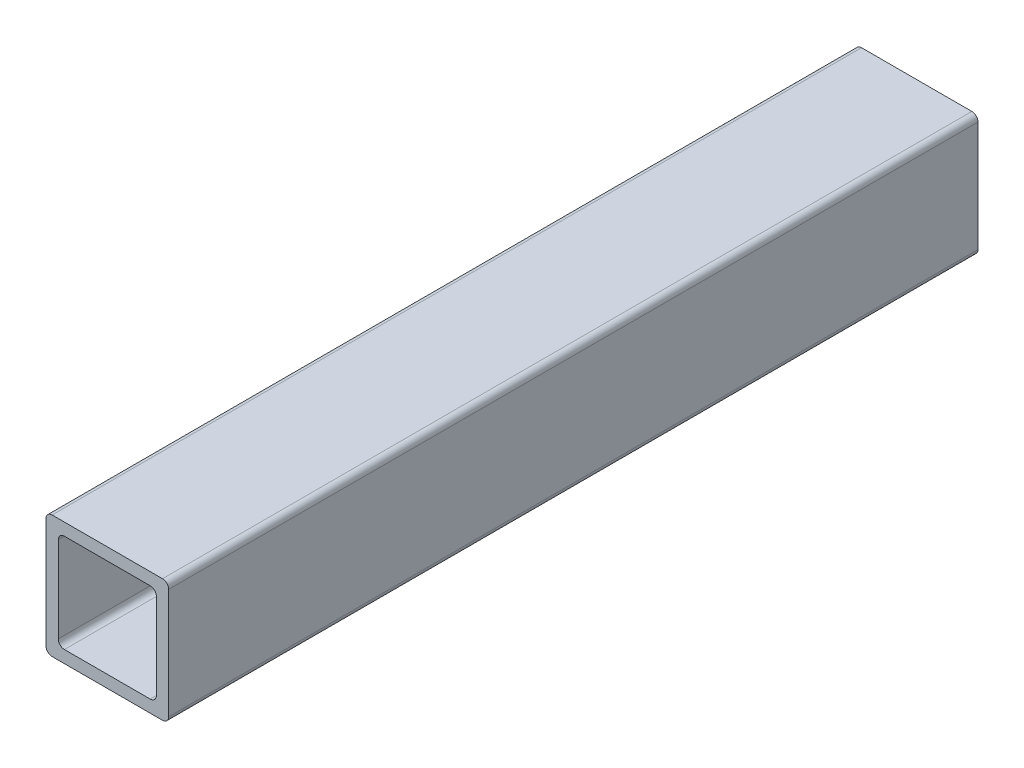
from build123d import *

# Parameters (mm, degrees)
BOSS_EXTRU_1_DEPTH = 264


with BuildPart() as part:
    # Esquisse2 → Boss.-Extru.1 (new body)
    with BuildSketch(Plane.XY):
        with BuildLine():
            Line((2, 0), (38, 0))
            ThreePointArc((38, 0), (39.414213562, 0.585786438), (40, 2))
            Line((40, 2), (40, 38))
            ThreePointArc((40, 38), (39.414213562, 39.414213562), (38, 40))
            Line((38, 40), (2, 40))
            ThreePointArc((2, 40), (0.585786438, 39.414213562), (0, 38))
            Line((0, 38), (0, 2))
            ThreePointArc((0, 2), (0.585786438, 0.585786438), (2, 0))
        make_face()
        with BuildLine():
            Line((6, 4), (34, 4))
            ThreePointArc((34, 4), (35.414213562, 4.585786438), (36, 6))
            Line((36, 6), (36, 34))
            ThreePointArc((36, 34), (35.414213562, 35.414213562), (34, 36))
            Line((34, 36), (6, 36))
            ThreePointArc((6, 36), (4.585786438, 35.414213562), (4, 34))
            Line((4, 34), (4, 6))
            ThreePointArc((4, 6), (4.585786438, 4.585786438), (6, 4))
        make_face(mode=Mode.SUBTRACT)
    extrude(amount=BOSS_EXTRU_1_DEPTH)


solid = part.part
